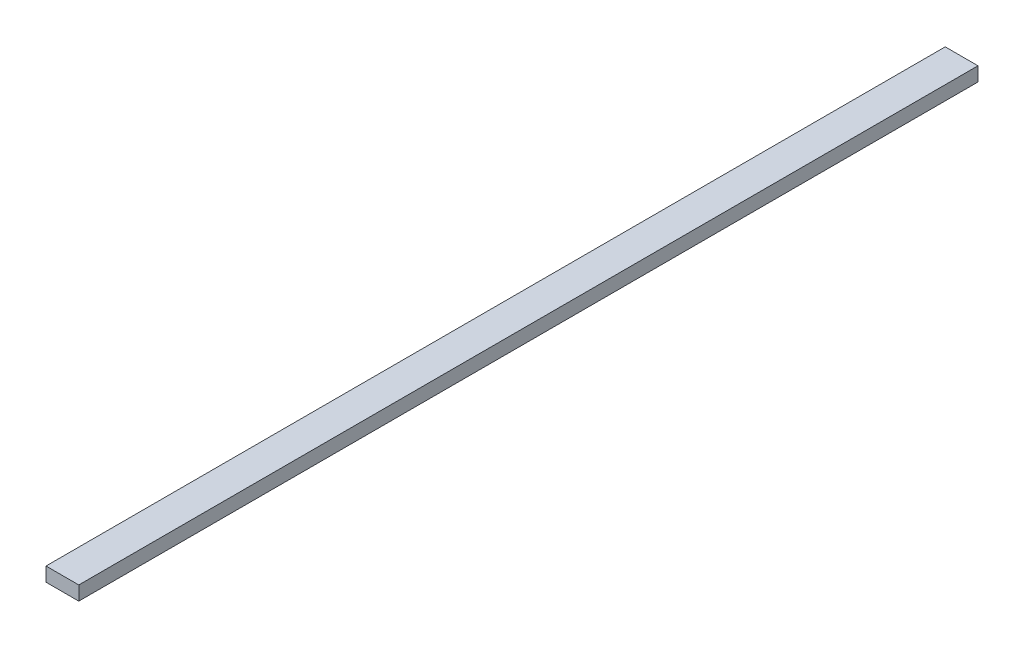
from build123d import *

# Parameters (mm, degrees)
SKETCH1_W           = 88.9
SKETCH1_H           = 38.1
BOSS_EXTRUDE1_DEPTH = 2438.4


with BuildPart() as part:
    # Sketch1 → Boss-Extrude1 (new body)
    with BuildSketch(Plane.XY):
        with Locations((44.45, 19.05)):
            Rectangle(SKETCH1_W, SKETCH1_H)
    extrude(amount=BOSS_EXTRUDE1_DEPTH)


solid = part.part
